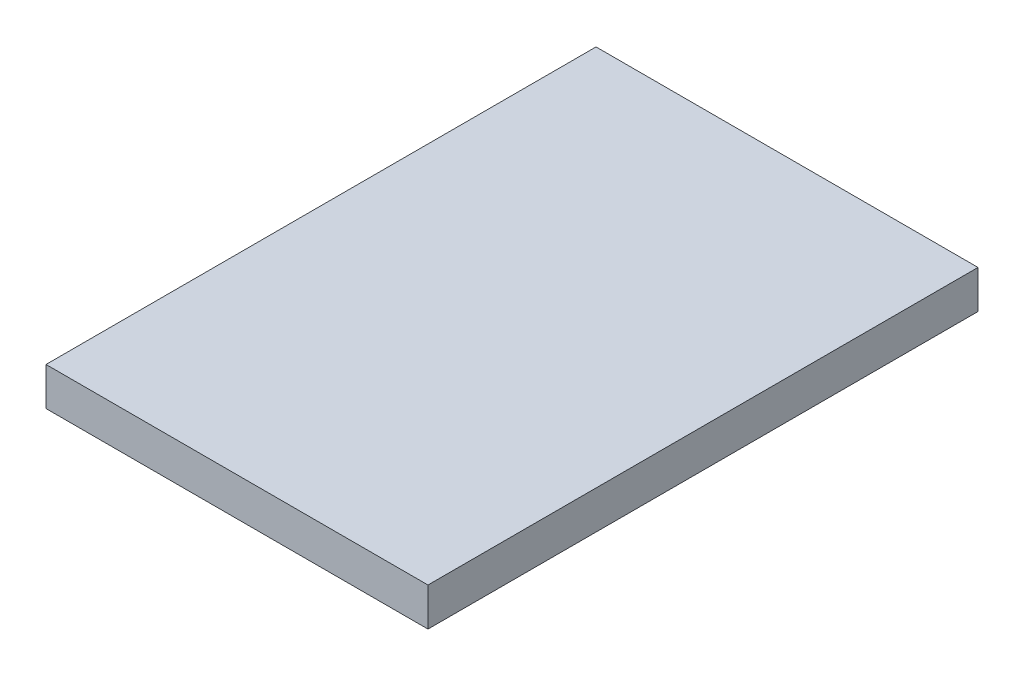
from build123d import *

# Parameters (mm, degrees)
SKETCH1_W           = 25
SKETCH1_H           = 36
BOSS_EXTRUDE1_DEPTH = 2.5


with BuildPart() as part:
    # Sketch1 → Boss-Extrude1 (new body)
    with BuildSketch(Plane(origin=(0, 0, 0), x_dir=(1, 0, 0), z_dir=(0, 1, 0))):
        Rectangle(SKETCH1_W, SKETCH1_H)
    extrude(amount=BOSS_EXTRUDE1_DEPTH)


solid = part.part
